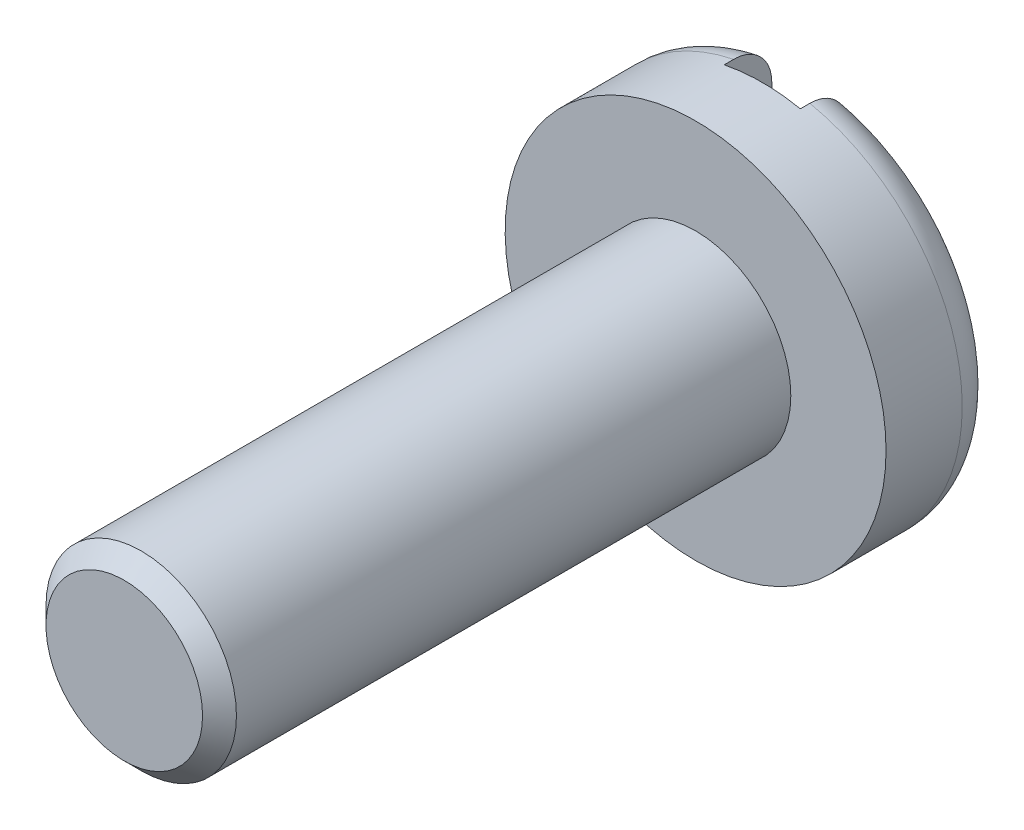
from build123d import *

# Parameters (mm, degrees)
SKETCH_1_R               = 5
EXTRUDE_1_DEPTH          = 3
SKETCH_2_R               = 2.5
EXTRUDE_2_DEPTH          = 15
FILLET_1_R               = 1
CUT_EXTRUDE_1_DEPTH      = 20.339079632
CUT_EXTRUDE_1_DEPTH_BACK = 20.339079632
SKETCH_3_W               = 2
SKETCH_3_H               = 2.5
CHAMFER_1_SIZE           = 0.445


with BuildPart() as part:
    # Эскиз1 → Бобышка-Вытянуть1 (new body)
    with BuildSketch(Plane.XY):
        Circle(SKETCH_1_R)
    extrude(amount=EXTRUDE_1_DEPTH)

    # Эскиз2 → Бобышка-Вытянуть2 (add)
    with BuildSketch(Plane.XY.offset(3)):
        Circle(SKETCH_2_R)
    extrude(amount=EXTRUDE_2_DEPTH)

    # Скругление1
    fillet_1_edges = [part.edges().sort_by_distance(p)[0] for p in [
        (-5, 0, 0),
    ]]
    fillet(fillet_1_edges, radius=FILLET_1_R)

    # Эскиз3 → Вырез-Вытянуть1 (cut, two sides: drawn at the far end of the back side and taken through both)
    with BuildSketch(Plane(origin=(0, 0, 0), x_dir=(1, 0, 0), z_dir=(0, 1, 0)).offset(-CUT_EXTRUDE_1_DEPTH_BACK)):
        Rectangle(SKETCH_3_W, SKETCH_3_H)
    extrude(amount=CUT_EXTRUDE_1_DEPTH + CUT_EXTRUDE_1_DEPTH_BACK, mode=Mode.SUBTRACT)

    # Фаска1
    chamfer_1_edges = [part.edges().sort_by_distance(p)[0] for p in [
        (-2.5, 0, 18),
    ]]
    chamfer(chamfer_1_edges, length=CHAMFER_1_SIZE)


solid = part.part
